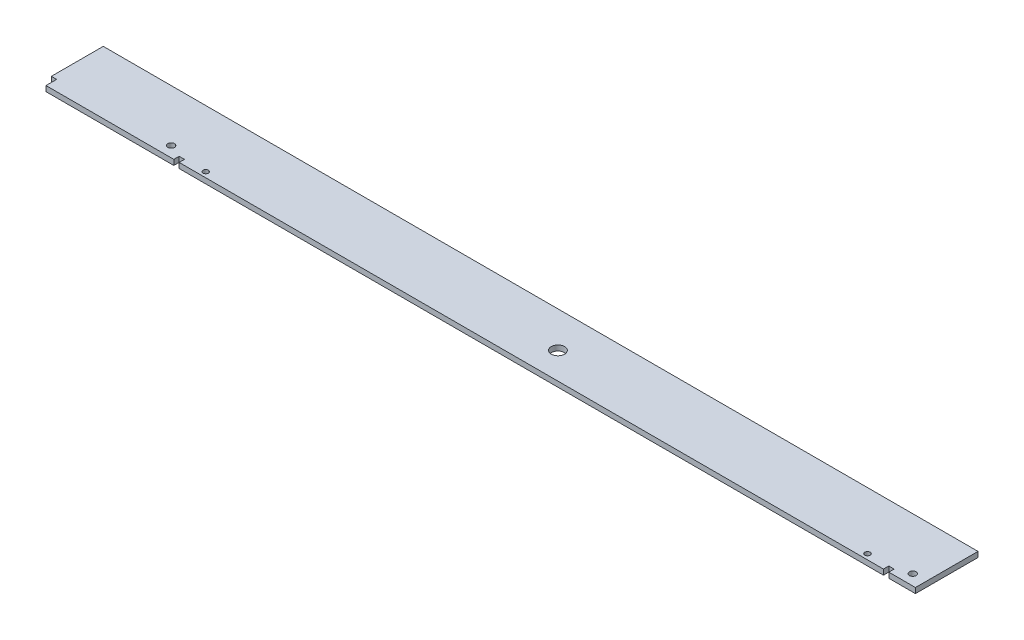
from build123d import *

# Parameters (mm, degrees)
SKETCH1_R           = 2.5
SKETCH1_R_2         = 2
SKETCH1_R_3         = 5
BOSS_EXTRUDE1_DEPTH = 4
SKETCH2_W           = 4
SKETCH2_H           = 8
CUT_EXTRUDE1_DEPTH  = 4


with BuildPart() as part:
    # Sketch1 → Boss-Extrude1 (new body)
    with BuildSketch(Plane(origin=(-317.41656051, 0, 154.910133377), x_dir=(-1, 0, 0), z_dir=(0, 1, 0))):
        Polygon((-187.536213895, 25.475039652), (-167.536213895, 25.475039652), (-167.536213895, 21.475039652), (-163.536213895, 21.475039652), (-163.536213895, 25.475039652), (365.463786105, 25.475039652), (365.463786105, 21.475039652), (369.463786105, 21.475039652), (369.463786105, 25.475039652), (469.463786105, 25.475039652), (469.463786105, -21.524960348), (-187.536213895, -21.524960348), align=None)
        with Locations(Location((379.463786105, 17.475039652, 0), (0, 0, 90))):
            Circle(SKETCH1_R, mode=Mode.SUBTRACT)
        with Locations(Location((-177.536213895, 17.475039652, 0), (0, 0, 90))):
            Circle(SKETCH1_R, mode=Mode.SUBTRACT)
        with Locations(Location((349.463786105, 21.475039652, 0), (0, 0, 90))):
            Circle(SKETCH1_R_2, mode=Mode.SUBTRACT)
        with Locations(Location((-147.536213895, 21.475039652, 0), (0, 0, 90))):
            Circle(SKETCH1_R_2, mode=Mode.SUBTRACT)
        with Locations(Location((100.963786105, 5.475039652, 0), (0, 0, 90))):
            Circle(SKETCH1_R_3, mode=Mode.SUBTRACT)
    extrude(amount=BOSS_EXTRUDE1_DEPTH)

    # Sketch2 → Cut-Extrude1 (cut)
    with BuildSketch(Plane.XZ):
        with Locations((-784.880346614, 176.385173028)):
            Rectangle(SKETCH2_W, SKETCH2_H)
    extrude(amount=-CUT_EXTRUDE1_DEPTH, mode=Mode.SUBTRACT)


solid = part.part
